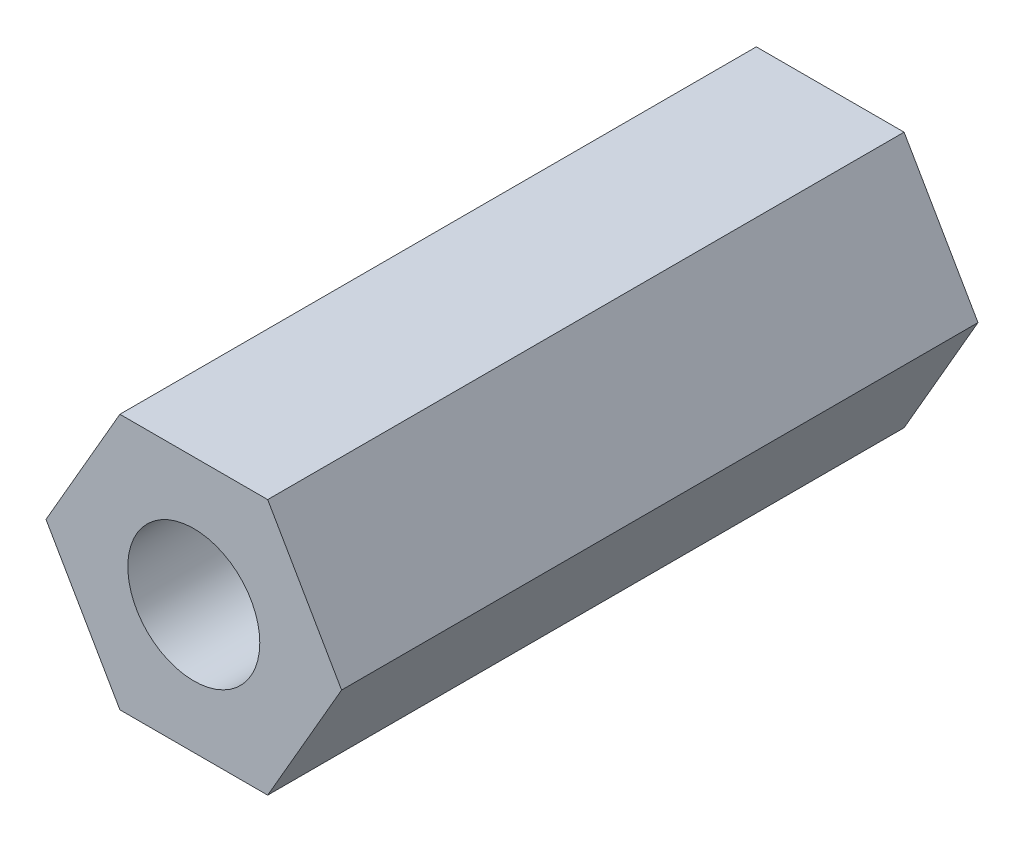
from build123d import *

# Parameters (mm, degrees)
IZIM1_R                     = 1.4
Y_KSEKLIK_EKSTR_ZYON1_DEPTH = 13.5


with BuildPart() as part:
    # Çizim1 → Yükseklik-Ekstrüzyon1 (new body)
    with BuildSketch(Plane.XY):
        Polygon((1.567505981, -2.715), (3.135011962, 0), (1.567505981, 2.715), (-1.567505981, 2.715), (-3.135011962, 0), (-1.567505981, -2.715), align=None)
        Circle(IZIM1_R, mode=Mode.SUBTRACT)
    extrude(amount=Y_KSEKLIK_EKSTR_ZYON1_DEPTH)


solid = part.part
